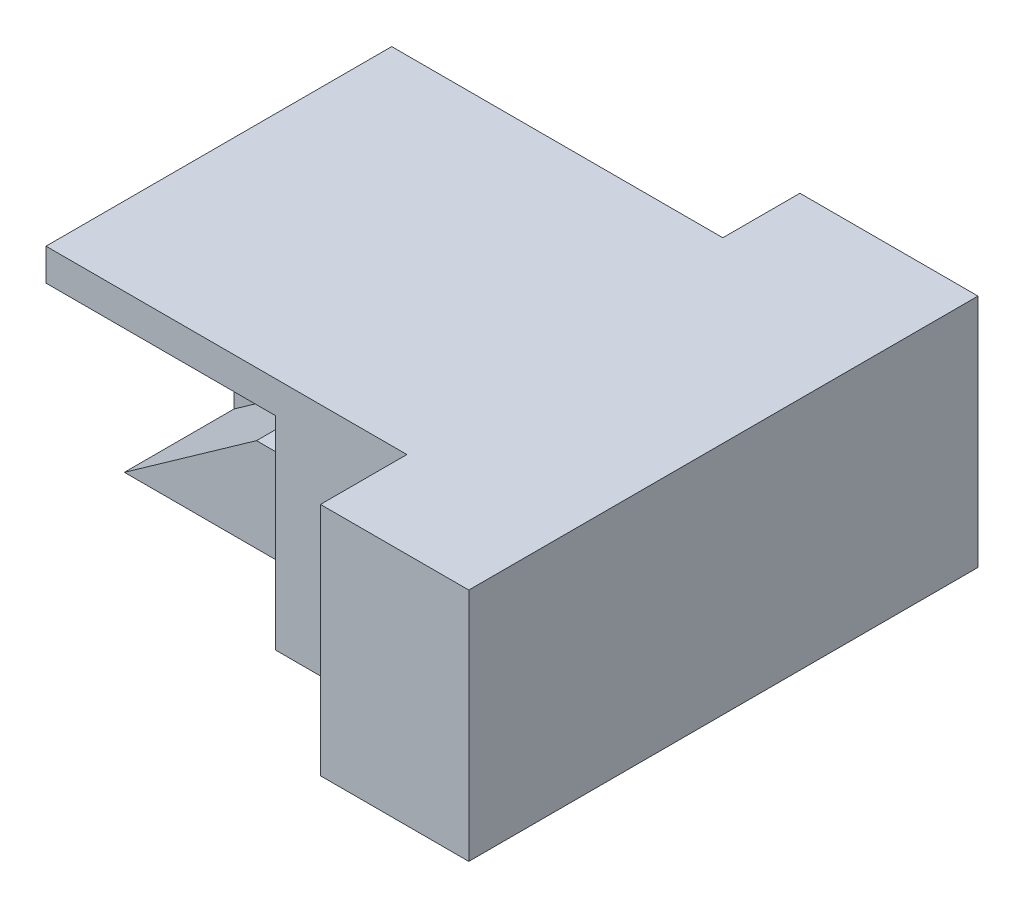
from build123d import *

# Parameters (mm, degrees)
EXTRUDE_1_DEPTH     = 30
CUT_EXTRUDE_1_DEPTH = 24
SKETCH_3_W          = 29.306250819
SKETCH_3_H          = 11.935792743
CUT_EXTRUDE_2_DEPTH = 10


with BuildPart() as part:
    # 草图1 → 凸台-拉伸1 (new body)
    with BuildSketch(Plane(origin=(0, 0, 0), x_dir=(1, 0, 0), z_dir=(0, 1, 0))):
        Polygon((-37.717889908, 18.188073394), (-37.717889908, -25.940366972), (8.348623853, -25.940366972), (8.348623853, -36.972477064), (27.282110092, -36.972477064), (27.282110092, 28.027522936), (4.548530182, 28.027522936), (4.548530182, 18.188073394), align=None)
    extrude(amount=EXTRUDE_1_DEPTH)

    # 草图2 → 切除-拉伸1 (cut)
    with BuildSketch(Plane.XY.offset(25.940366972)):
        Polygon((-37.717889908, 25.912398035), (-8.411639089, 25.912398035), (-8.411639089, 11.935792743), (-20.845998279, 11.935792743), (-37.717889908, 0), align=None)
    extrude(amount=-CUT_EXTRUDE_1_DEPTH, mode=Mode.SUBTRACT)

    # 草图3 → 切除-拉伸2 (cut)
    with BuildSketch(Plane.XY.offset(25.940366972)):
        with Locations((-23.064764499, 5.967896372)):
            Rectangle(SKETCH_3_W, SKETCH_3_H)
    extrude(amount=-CUT_EXTRUDE_2_DEPTH, mode=Mode.SUBTRACT)


solid = part.part
